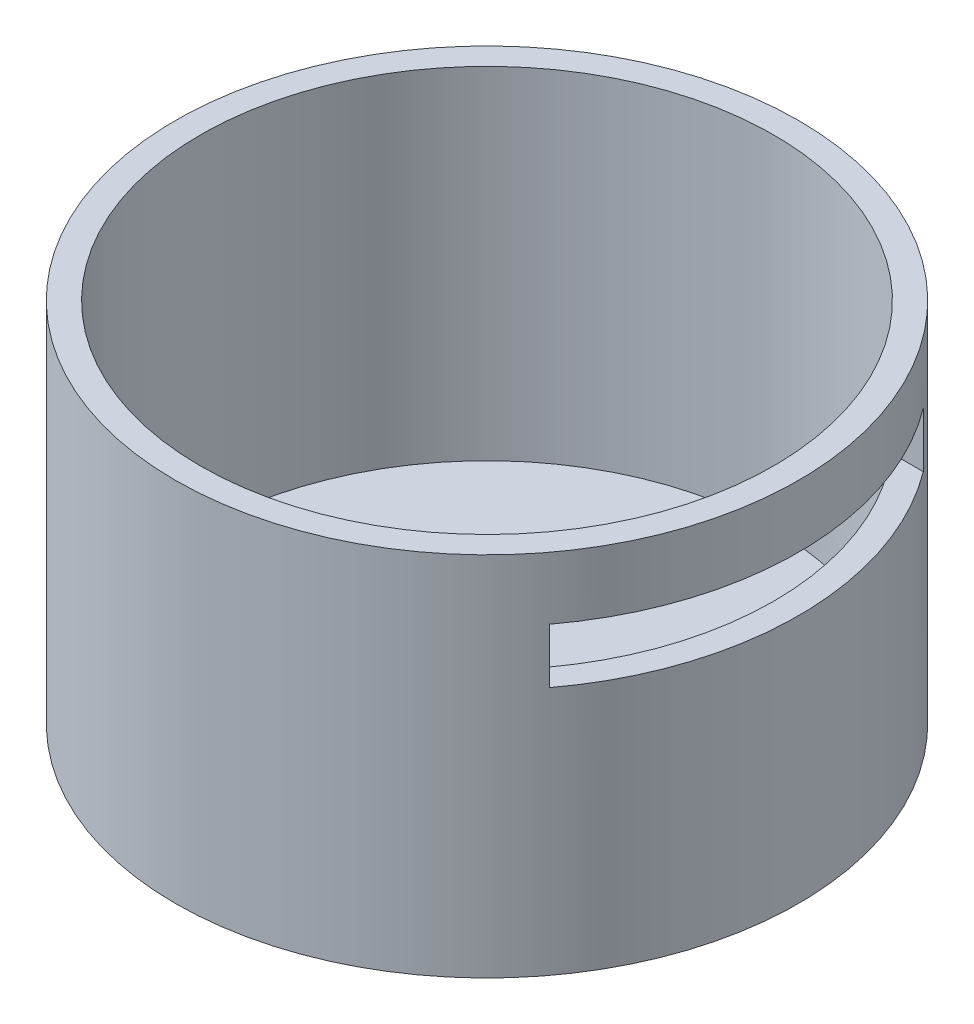
from build123d import *

# Parameters (mm, degrees)
SKETCH1_R           = 12.5
BOSS_EXTRUDE1_DEPTH = 14.7
SHELL1_T            = -1
SKETCH2_W           = 15
SKETCH2_H           = 2.2
CUT_EXTRUDE1_DEPTH  = 24.7


with BuildPart() as part:
    # Sketch1 → Boss-Extrude1 (new body)
    with BuildSketch(Plane(origin=(0, 0, 0), x_dir=(1, 0, 0), z_dir=(0, 1, 0))):
        with Locations(Location((0, 0, 0), (0, 0, 270))):
            Circle(SKETCH1_R)
    extrude(amount=BOSS_EXTRUDE1_DEPTH)

    # Shell1
    shell1_openings = [part.faces().sort_by_distance(p)[0] for p in [
        (0, 14.7, 0),
    ]]
    offset(amount=SHELL1_T, openings=shell1_openings, kind=Kind.INTERSECTION)

    # Sketch2 → Cut-Extrude1 (cut)
    with BuildSketch(Plane(origin=(0, 0, 0), x_dir=(0, 0, -1), z_dir=(1, 0, 0))):
        with Locations((0, 11.1)):
            Rectangle(SKETCH2_W, SKETCH2_H)
    extrude(amount=CUT_EXTRUDE1_DEPTH, mode=Mode.SUBTRACT)


solid = part.part
